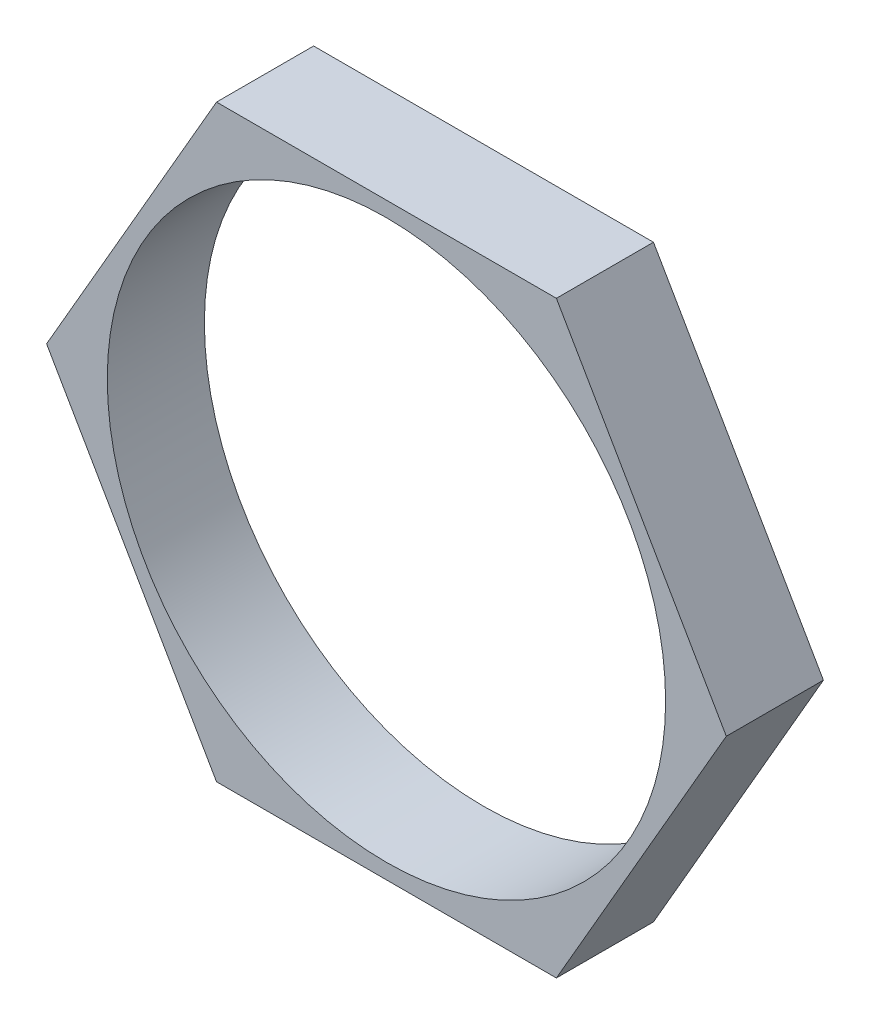
from build123d import *

# Parameters (mm, degrees)
SKETCH_1_R      = 5.75
EXTRUDE_1_DEPTH = 2


with BuildPart() as part:
    # 草图1 → 凸台-拉伸1 (new body)
    with BuildSketch(Plane.XY):
        Polygon((7, 0), (3.5, 6.062177826), (-3.5, 6.062177826), (-7, 0), (-3.5, -6.062177826), (3.5, -6.062177826), align=None)
        Circle(SKETCH_1_R, mode=Mode.SUBTRACT)
    extrude(amount=EXTRUDE_1_DEPTH)


solid = part.part
